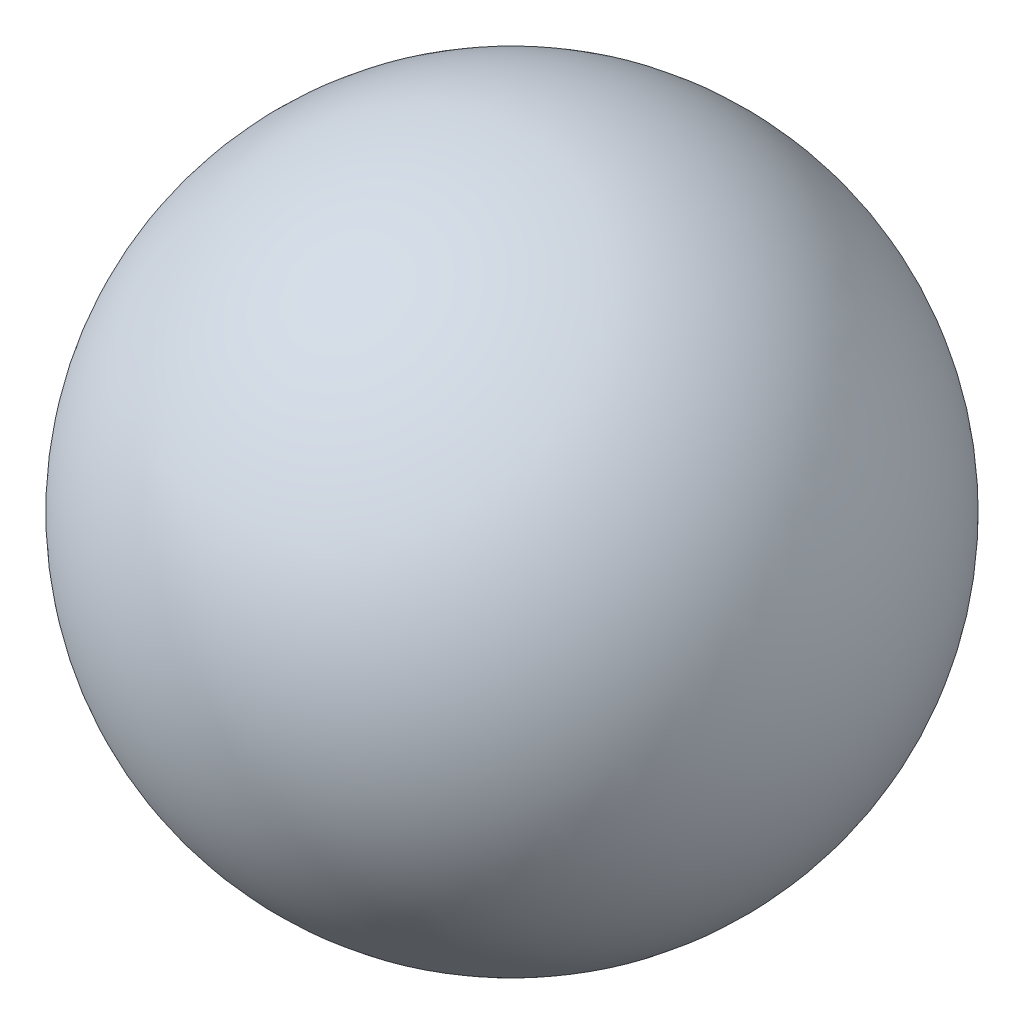
from build123d import *


with BuildPart() as part:
    # Esboço1 → Revolução1 (revolve)
    with BuildSketch(Plane.XY):
        with BuildLine():
            Line((0, 2.75), (0, -2.75))
            ThreePointArc((0, -2.75), (-2.75, 0), (0, 2.75))
        make_face()
    revolve(axis=Axis((0, -2.75, 0), (0, 1, 0)))


solid = part.part
